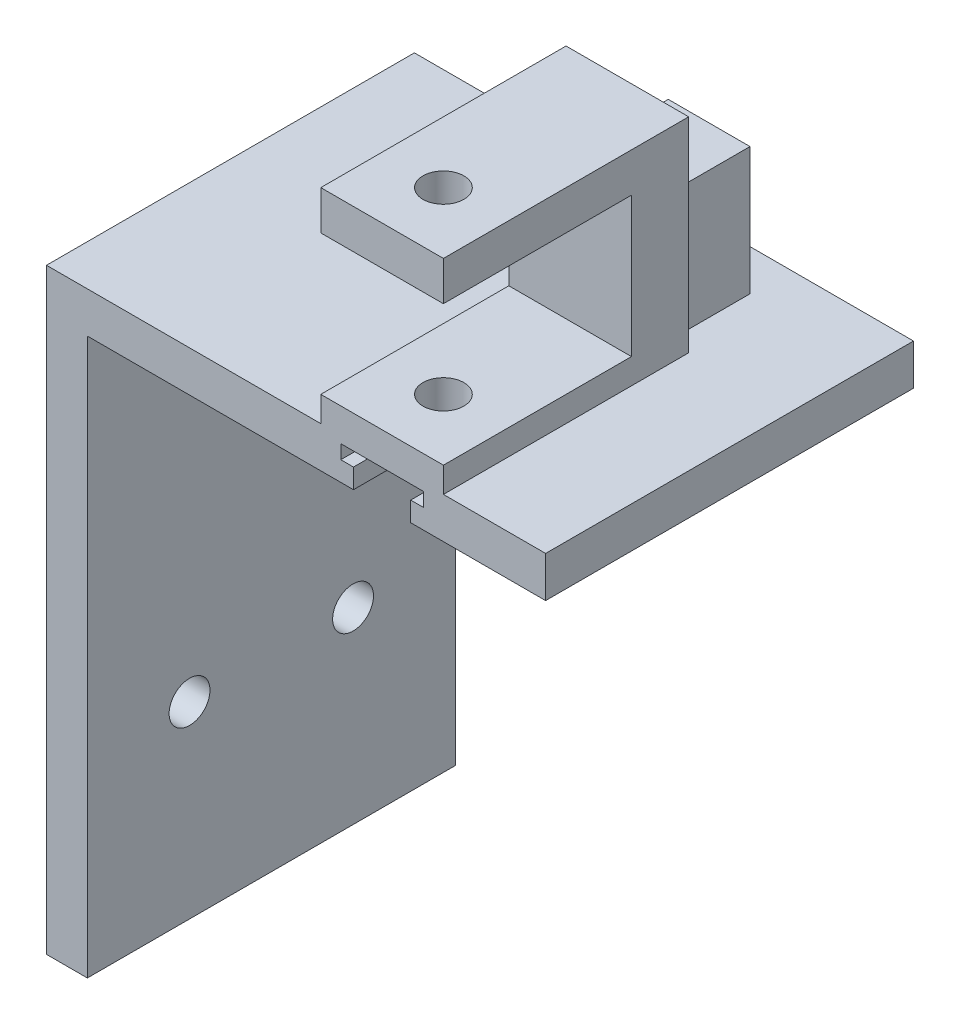
from build123d import *

# Parameters (mm, degrees)
SKETCH1_W           = 61.05
SKETCH1_H           = 45
BOSS_EXTRUDE2_DEPTH = 5
SKETCH2_W           = 10
SKETCH2_H           = 10
BOSS_EXTRUDE3_DEPTH = 15.6
SKETCH3_R           = 4
CUT_EXTRUDE1_DEPTH  = 8
SKETCH6_W           = 15
SKETCH6_H           = 30
BOSS_EXTRUDE4_DEPTH = 25
SKETCH7_W           = 27.5
SKETCH7_H           = 17.1
CUT_EXTRUDE3_DEPTH  = 23
SKETCH8_R           = 2.5
CUT_EXTRUDE4_DEPTH  = 82.560422387
SKETCH9_W           = 5
SKETCH9_H           = 45
BOSS_EXTRUDE5_DEPTH = 68
SKETCH10_R          = 2.5
CUT_EXTRUDE5_DEPTH  = 5
CUT_EXTRUDE6_DEPTH  = 16


with BuildPart() as part:
    # Sketch1 → Boss-Extrude2 (new body)
    with BuildSketch(Plane(origin=(0, 0, 0), x_dir=(1, 0, 0), z_dir=(0, 1, 0))):
        with Locations((30.525, 22.5)):
            Rectangle(SKETCH1_W, SKETCH1_H)
    extrude(amount=BOSS_EXTRUDE2_DEPTH)

    # Sketch2 → Boss-Extrude3 (add)
    with BuildSketch(Plane(origin=(0, 5, 0), x_dir=(1, 0, 0), z_dir=(0, 1, 0))):
        with Locations((41.05, 35)):
            Rectangle(SKETCH2_W, SKETCH2_H)
    extrude(amount=BOSS_EXTRUDE3_DEPTH)

    # Sketch3 → Cut-Extrude1 (cut)
    with BuildSketch(Plane(origin=(0, 0, -40), x_dir=(-1, 0, 0), z_dir=(0, 0, -1))):
        with Locations((-41.05, 14)):
            Circle(SKETCH3_R)
    extrude(amount=-CUT_EXTRUDE1_DEPTH, mode=Mode.SUBTRACT)

    # Sketch6 → Boss-Extrude4 (add)
    with BuildSketch(Plane(origin=(0, 5, 0), x_dir=(1, 0, 0), z_dir=(0, 1, 0))):
        with Locations((41.05, 15)):
            Rectangle(SKETCH6_W, SKETCH6_H)
    extrude(amount=BOSS_EXTRUDE4_DEPTH)

    # Sketch7 → Cut-Extrude3 (cut)
    with BuildSketch(Plane.XY):
        with Locations((47.3, 16.65)):
            Rectangle(SKETCH7_W, SKETCH7_H)
    extrude(amount=-CUT_EXTRUDE3_DEPTH, mode=Mode.SUBTRACT)

    # Sketch8 → Cut-Extrude4 (cut, through all)
    with BuildSketch(Plane(origin=(0, 30, 0), x_dir=(1, 0, 0), z_dir=(0, 1, 0))):
        with Locations(Location((41.05, 7.5, 0), (0, 0, 270))):
            Circle(SKETCH8_R)
    extrude(amount=-CUT_EXTRUDE4_DEPTH, mode=Mode.SUBTRACT)

    # Sketch9 → Boss-Extrude5 (add)
    with BuildSketch(Plane.XZ):
        with Locations((2.5, -22.5)):
            Rectangle(SKETCH9_W, SKETCH9_H)
    extrude(amount=BOSS_EXTRUDE5_DEPTH)

    # Sketch10 → Cut-Extrude5 (cut)
    with BuildSketch(Plane.ZY):
        with Locations((-32.5, -45)):
            Circle(SKETCH10_R)
        with Locations((-12.5, -45)):
            Circle(SKETCH10_R)
    extrude(amount=-CUT_EXTRUDE5_DEPTH, mode=Mode.SUBTRACT)

    # Sketch11 → Cut-Extrude6 (cut)
    with BuildSketch(Plane.XY):
        Polygon((46.1, 2.4), (46.1, 4.1), (36, 4.1), (36, 2.4), (37.55, 2.4), (37.55, -1.509753214), (44.55, -1.509753214), (44.55, 2.4), align=None)
    extrude(amount=-CUT_EXTRUDE6_DEPTH, mode=Mode.SUBTRACT)


solid = part.part
